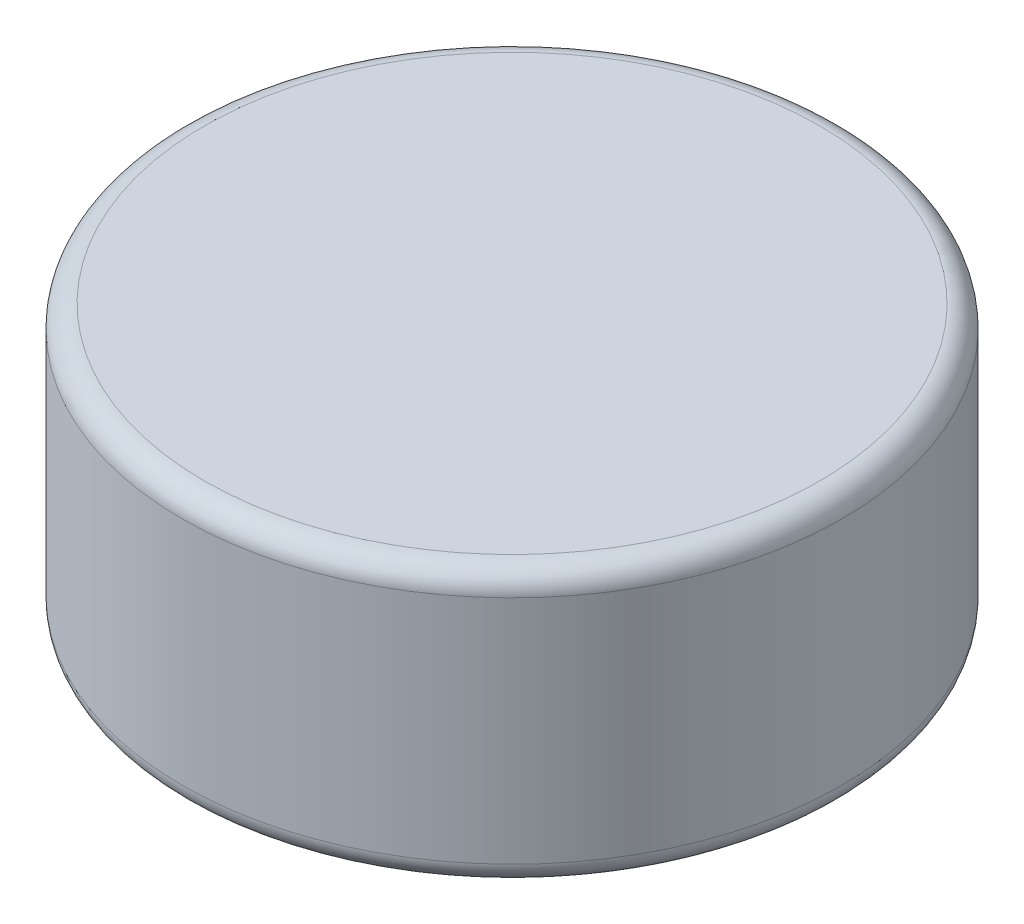
from build123d import *

# Parameters (mm, degrees)
SKETCH1_R           = 3
BOSS_EXTRUDE1_DEPTH = 2.5
FILLET1_R           = 0.2


with BuildPart() as part:
    # Sketch1 → Boss-Extrude1 (new body)
    with BuildSketch(Plane(origin=(0, 0, 0), x_dir=(1, 0, 0), z_dir=(0, 1, 0))):
        with Locations(Location((0, 0, 0), (0, 0, 270))):
            Circle(SKETCH1_R)
    extrude(amount=BOSS_EXTRUDE1_DEPTH)

    # Fillet1
    fillet1_edges = [part.edges().sort_by_distance(p)[0] for p in [
        (0, 0, -3),
        (0, 2.5, -3),
    ]]
    fillet(fillet1_edges, radius=FILLET1_R)


solid = part.part
